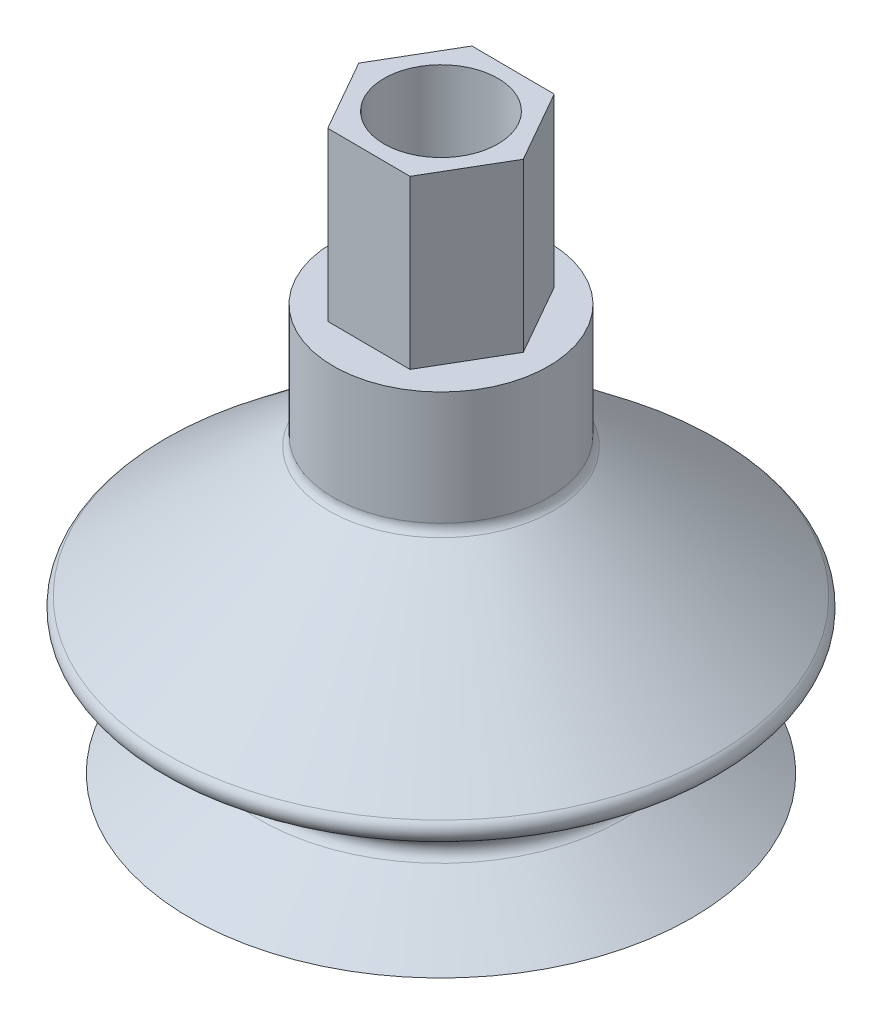
from build123d import *

# Parameters (mm, degrees)
CASCA1_T                 = -0.9
FILETE1_R                = 1
RESSALTO_EXTRUS_O1_DEPTH = 14
ESBO_O3_R                = 4.7625
CORTE_EXTRUS_O1_DEPTH    = 59.247826304


with BuildPart() as part:
    # Esboço1 → Revolução1 (revolve)
    with BuildSketch(Plane.XY, mode=Mode.PRIVATE) as revolu_o1_sk:
        Polygon((0, 0), (21, 0), (14, 5), (24, 12), (9, 24), (9, 34), (0, 34), align=None)
    revolve(revolu_o1_sk.sketch.rotate(Axis((0, 34, 0), (0, -1, 0)), 180), axis=Axis((0, 34, 0), (0, -1, 0)))

    # Casca1
    casca1_openings = [part.faces().sort_by_distance(p)[0] for p in [
        (0, 0, 0),
    ]]
    offset(amount=CASCA1_T, openings=casca1_openings, kind=Kind.INTERSECTION)

    # Filete1
    filete1_edges = [part.edges().sort_by_distance(p)[0] for p in [
        (9, 24, 0),
        (24, 12, 0),
        (14, 5, 0),
    ]]
    fillet(filete1_edges, radius=FILETE1_R)

    # Esboço2 → Ressalto-extrusão1 (add)
    with BuildSketch(Plane(origin=(0, 34, 0), x_dir=(1, 0, 0), z_dir=(0, 1, 0))):
        Polygon((3.499984176, 5.979139634), (-3.428094728, 6.020645027), (-6.928078904, 0.041505392), (-3.499984176, -5.979139634), (3.428094728, -6.020645027), (6.928078904, -0.041505392), align=None)
    extrude(amount=RESSALTO_EXTRUS_O1_DEPTH)

    # Esboço3 → Corte-extrusão1 (cut, through all)
    with BuildSketch(Plane(origin=(0, 48, 0), x_dir=(1, 0, 0), z_dir=(0, 1, 0))):
        with Locations(Location((0, 0, 0), (0, 0, 270))):
            Circle(ESBO_O3_R)
    extrude(amount=-CORTE_EXTRUS_O1_DEPTH, mode=Mode.SUBTRACT)


solid = part.part
